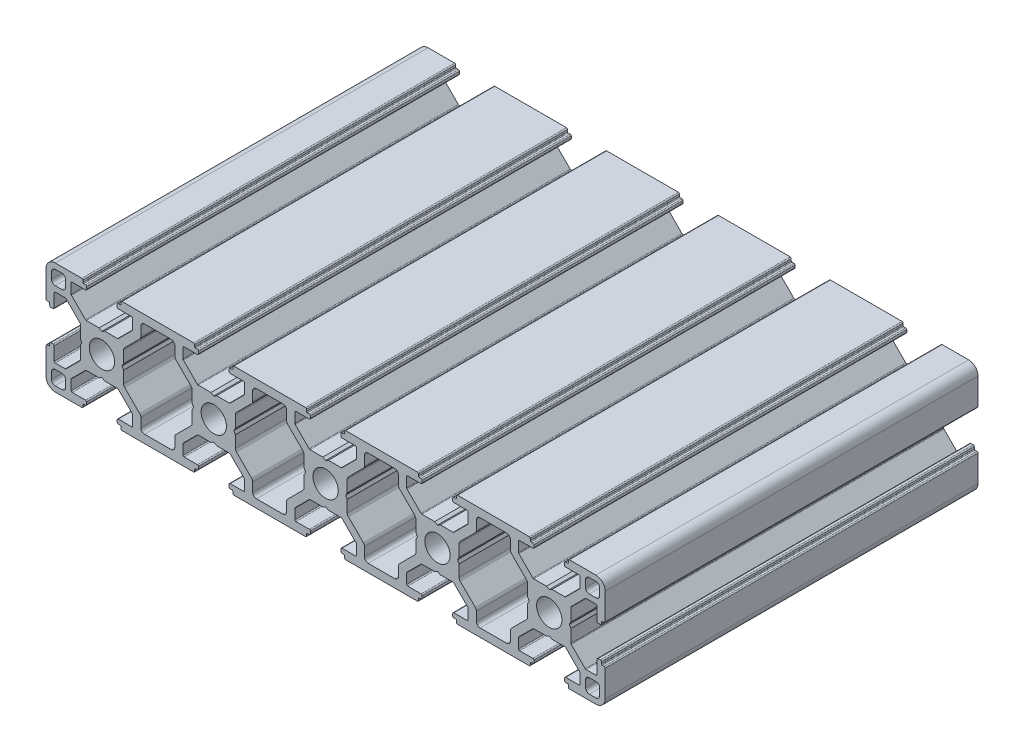
from build123d import *

# Parameters (mm, degrees)
SKETCH_1_R      = 3.400000029
EXTRUDE_1_DEPTH = 100


with BuildPart() as part:
    # 草图1 → 凸台-拉伸1 (new body)
    with BuildSketch(Plane.XY):
        with BuildLine():
            Line((25.811431149, -5.800000049), (29.249998985, -5.800000049))
            Line((29.249998985, -5.800000049), (29.999998991, -5.366987343))
            Line((29.999998991, -5.366987343), (30.749998997, -5.800000049))
            Line((30.749998997, -5.800000049), (34.188566832, -5.800000049))
            ThreePointArc((34.188566832, -5.800000049), (34.303402086, -5.82284871), (34.400745128, -5.887914284))
            Line((34.400745128, -5.887914284), (38.162177353, -9.650987533))
            ThreePointArc((38.162177353, -9.650987533), (38.227175437, -9.748298493), (38.24999906, -9.8630733))
            Line((38.24999906, -9.8630733), (38.24999906, -12.500000105))
            ThreePointArc((38.24999906, -12.500000105), (38.162131094, -12.712132141), (37.949999058, -12.800000108))
            Line((37.949999058, -12.800000108), (34.399999028, -12.800000108))
            ThreePointArc((34.399999028, -12.800000108), (34.187866992, -12.887868074), (34.099999025, -13.10000011))
            Line((34.099999025, -13.10000011), (34.099999025, -13.700000115))
            ThreePointArc((34.099999025, -13.700000115), (34.187866992, -13.912132151), (34.399999028, -14.000000118))
            Line((34.399999028, -14.000000118), (34.899999032, -14.000000118))
            ThreePointArc((34.899999032, -14.000000118), (35.04142039, -14.058578762), (35.099999034, -14.200000119))
            Line((35.099999034, -14.200000119), (35.099999034, -14.700000124))
            ThreePointArc((35.099999034, -14.700000124), (35.187867, -14.91213216), (35.399999036, -15.000000126))
            Line((35.399999036, -15.000000126), (54.599999198, -15.000000126))
            ThreePointArc((54.599999198, -15.000000126), (54.812131234, -14.91213216), (54.8999992, -14.700000124))
            Line((54.8999992, -14.700000124), (54.8999992, -14.200000119))
            ThreePointArc((54.8999992, -14.200000119), (54.958577845, -14.058578762), (55.099999202, -14.000000118))
            Line((55.099999202, -14.000000118), (55.599999206, -14.000000118))
            ThreePointArc((55.599999206, -14.000000118), (55.812131242, -13.912132151), (55.899999209, -13.700000115))
            Line((55.899999209, -13.700000115), (55.899999209, -13.10000011))
            ThreePointArc((55.899999209, -13.10000011), (55.812131242, -12.887868074), (55.599999206, -12.800000108))
            Line((55.599999206, -12.800000108), (52.049999176, -12.800000108))
            ThreePointArc((52.049999176, -12.800000108), (51.83786714, -12.712132141), (51.749999174, -12.500000105))
            Line((51.749999174, -12.500000105), (51.749999174, -9.8630733))
            ThreePointArc((51.749999174, -9.8630733), (51.772822797, -9.748298493), (51.837820881, -9.650987533))
            Line((51.837820881, -9.650987533), (55.599253107, -5.887914284))
            ThreePointArc((55.599253107, -5.887914284), (55.696596148, -5.82284871), (55.811431402, -5.800000049))
            Line((55.811431402, -5.800000049), (59.249999237, -5.800000049))
            Line((59.249999237, -5.800000049), (59.999999243, -5.366987343))
            Line((59.999999243, -5.366987343), (60.749999249, -5.800000049))
            Line((60.749999249, -5.800000049), (64.188567085, -5.800000049))
            ThreePointArc((64.188567085, -5.800000049), (64.303402338, -5.82284871), (64.40074538, -5.887914284))
            Line((64.40074538, -5.887914284), (68.162177605, -9.650987533))
            ThreePointArc((68.162177605, -9.650987533), (68.227175689, -9.748298493), (68.249999313, -9.8630733))
            Line((68.249999313, -9.8630733), (68.249999313, -12.500000105))
            ThreePointArc((68.249999313, -12.500000105), (68.162131346, -12.712132141), (67.94999931, -12.800000108))
            Line((67.94999931, -12.800000108), (64.39999928, -12.800000108))
            ThreePointArc((64.39999928, -12.800000108), (64.187867244, -12.887868074), (64.099999278, -13.10000011))
            Line((64.099999278, -13.10000011), (64.099999278, -13.700000115))
            ThreePointArc((64.099999278, -13.700000115), (64.187867244, -13.912132151), (64.39999928, -14.000000118))
            Line((64.39999928, -14.000000118), (64.899999284, -14.000000118))
            ThreePointArc((64.899999284, -14.000000118), (65.041420642, -14.058578762), (65.099999286, -14.200000119))
            Line((65.099999286, -14.200000119), (65.099999286, -14.700000124))
            ThreePointArc((65.099999286, -14.700000124), (65.187867252, -14.91213216), (65.399999289, -15.000000126))
            Line((65.399999289, -15.000000126), (84.59999945, -15.000000126))
            ThreePointArc((84.59999945, -15.000000126), (84.812131486, -14.91213216), (84.899999453, -14.700000124))
            Line((84.899999453, -14.700000124), (84.899999453, -14.200000119))
            ThreePointArc((84.899999453, -14.200000119), (84.958578097, -14.058578762), (85.099999454, -14.000000118))
            Line((85.099999454, -14.000000118), (85.599999458, -14.000000118))
            ThreePointArc((85.599999458, -14.000000118), (85.812131495, -13.912132151), (85.899999461, -13.700000115))
            Line((85.899999461, -13.700000115), (85.899999461, -13.10000011))
            ThreePointArc((85.899999461, -13.10000011), (85.812131495, -12.887868074), (85.599999458, -12.800000108))
            Line((85.599999458, -12.800000108), (82.049999429, -12.800000108))
            ThreePointArc((82.049999429, -12.800000108), (81.837867392, -12.712132141), (81.749999426, -12.500000105))
            Line((81.749999426, -12.500000105), (81.749999426, -9.8630733))
            ThreePointArc((81.749999426, -9.8630733), (81.772823049, -9.748298493), (81.837821134, -9.650987533))
            Line((81.837821134, -9.650987533), (85.599253359, -5.887914284))
            ThreePointArc((85.599253359, -5.887914284), (85.696596401, -5.82284871), (85.811431654, -5.800000049))
            Line((85.811431654, -5.800000049), (89.249999489, -5.800000049))
            Line((89.249999489, -5.800000049), (89.999999495, -5.366987343))
            Line((89.999999495, -5.366987343), (90.749999502, -5.800000049))
            Line((90.749999502, -5.800000049), (94.188567337, -5.800000049))
            ThreePointArc((94.188567337, -5.800000049), (94.30340259, -5.82284871), (94.400745632, -5.887914284))
            Line((94.400745632, -5.887914284), (98.162177857, -9.650987533))
            ThreePointArc((98.162177857, -9.650987533), (98.227175942, -9.748298493), (98.249999565, -9.8630733))
            Line((98.249999565, -9.8630733), (98.249999565, -12.500000105))
            ThreePointArc((98.249999565, -12.500000105), (98.162131598, -12.712132141), (97.949999562, -12.800000108))
            Line((97.949999562, -12.800000108), (94.399999532, -12.800000108))
            ThreePointArc((94.399999532, -12.800000108), (94.187867496, -12.887868074), (94.09999953, -13.10000011))
            Line((94.09999953, -13.10000011), (94.09999953, -13.700000115))
            ThreePointArc((94.09999953, -13.700000115), (94.187867496, -13.912132151), (94.399999532, -14.000000118))
            Line((94.399999532, -14.000000118), (94.899999537, -14.000000118))
            ThreePointArc((94.899999537, -14.000000118), (95.041420894, -14.058578762), (95.099999538, -14.200000119))
            Line((95.099999538, -14.200000119), (95.099999538, -14.700000124))
            ThreePointArc((95.099999538, -14.700000124), (95.187867505, -14.91213216), (95.399999541, -15.000000126))
            Line((95.399999541, -15.000000126), (114.599999703, -15.000000126))
            ThreePointArc((114.599999703, -15.000000126), (114.812131739, -14.91213216), (114.899999705, -14.700000124))
            Line((114.899999705, -14.700000124), (114.899999705, -14.200000119))
            ThreePointArc((114.899999705, -14.200000119), (114.958578349, -14.058578762), (115.099999707, -14.000000118))
            Line((115.099999707, -14.000000118), (115.599999711, -14.000000118))
            ThreePointArc((115.599999711, -14.000000118), (115.812131747, -13.912132151), (115.899999713, -13.700000115))
            Line((115.899999713, -13.700000115), (115.899999713, -13.10000011))
            ThreePointArc((115.899999713, -13.10000011), (115.812131747, -12.887868074), (115.599999711, -12.800000108))
            Line((115.599999711, -12.800000108), (112.049999681, -12.800000108))
            ThreePointArc((112.049999681, -12.800000108), (111.837867645, -12.712132141), (111.749999678, -12.500000105))
            Line((111.749999678, -12.500000105), (111.749999678, -9.8630733))
            ThreePointArc((111.749999678, -9.8630733), (111.772823301, -9.748298493), (111.837821386, -9.650987533))
            Line((111.837821386, -9.650987533), (115.599253611, -5.887914284))
            ThreePointArc((115.599253611, -5.887914284), (115.696596653, -5.82284871), (115.811431906, -5.800000049))
            Line((115.811431906, -5.800000049), (119.249999741, -5.800000049))
            Line((119.249999741, -5.800000049), (119.999999748, -5.366987343))
            Line((119.999999748, -5.366987343), (120.749999754, -5.800000049))
            Line((120.749999754, -5.800000049), (124.188567589, -5.800000049))
            ThreePointArc((124.188567589, -5.800000049), (124.303402843, -5.82284871), (124.400745884, -5.887914284))
            Line((124.400745884, -5.887914284), (128.16217811, -9.650987533))
            ThreePointArc((128.16217811, -9.650987533), (128.227176194, -9.748298493), (128.249999817, -9.8630733))
            Line((128.249999817, -9.8630733), (128.249999817, -12.500000105))
            ThreePointArc((128.249999817, -12.500000105), (128.162131851, -12.712132141), (127.949999815, -12.800000108))
            Line((127.949999815, -12.800000108), (124.399999785, -12.800000108))
            ThreePointArc((124.399999785, -12.800000108), (124.187867749, -12.887868074), (124.099999782, -13.10000011))
            Line((124.099999782, -13.10000011), (124.099999782, -13.700000115))
            ThreePointArc((124.099999782, -13.700000115), (124.187867749, -13.912132151), (124.399999785, -14.000000118))
            Line((124.399999785, -14.000000118), (124.899999789, -14.000000118))
            ThreePointArc((124.899999789, -14.000000118), (125.041421146, -14.058578762), (125.099999791, -14.200000119))
            Line((125.099999791, -14.200000119), (125.099999791, -14.700000124))
            ThreePointArc((125.099999791, -14.700000124), (125.187867757, -14.91213216), (125.399999793, -15.000000126))
            Line((125.399999793, -15.000000126), (132.499999853, -15.000000126))
            ThreePointArc((132.499999853, -15.000000126), (134.267766821, -14.267767073), (134.999999874, -12.500000105))
            Line((134.999999874, -12.500000105), (134.999999874, -5.400000045))
            ThreePointArc((134.999999874, -5.400000045), (134.912131907, -5.187868009), (134.699999871, -5.100000043))
            Line((134.699999871, -5.100000043), (134.199999867, -5.100000043))
            ThreePointArc((134.199999867, -5.100000043), (134.05857851, -5.041421399), (133.999999865, -4.900000041))
            Line((133.999999865, -4.900000041), (133.999999865, -4.400000037))
            ThreePointArc((133.999999865, -4.400000037), (133.912131899, -4.187868001), (133.699999863, -4.100000034))
            Line((133.699999863, -4.100000034), (133.099999858, -4.100000034))
            ThreePointArc((133.099999858, -4.100000034), (132.887867822, -4.187868001), (132.799999855, -4.400000037))
            Line((132.799999855, -4.400000037), (132.799999855, -7.950000067))
            ThreePointArc((132.799999855, -7.950000067), (132.712131889, -8.162132103), (132.499999853, -8.250000069))
            Line((132.499999853, -8.250000069), (129.855305017, -8.250000069))
            ThreePointArc((129.855305017, -8.250000069), (129.740469764, -8.227151408), (129.643126722, -8.162085834))
            Line((129.643126722, -8.162085834), (125.887821504, -4.405142266))
            ThreePointArc((125.887821504, -4.405142266), (125.82282342, -4.307831305), (125.799999796, -4.193056499))
            Line((125.799999796, -4.193056499), (125.799999796, -0.750000006))
            Line((125.799999796, -0.750000006), (125.366987091, 0))
            Line((125.366987091, 0), (125.799999796, 0.750000006))
            Line((125.799999796, 0.750000006), (125.799999796, 4.193056499))
            ThreePointArc((125.799999796, 4.193056499), (125.82282342, 4.307831305), (125.887821504, 4.405142266))
            Line((125.887821504, 4.405142266), (129.643126722, 8.162085834))
            ThreePointArc((129.643126722, 8.162085834), (129.740469764, 8.227151408), (129.855305017, 8.250000069))
            Line((129.855305017, 8.250000069), (132.499999853, 8.250000069))
            ThreePointArc((132.499999853, 8.250000069), (132.712131889, 8.162132103), (132.799999855, 7.950000067))
            Line((132.799999855, 7.950000067), (132.799999855, 4.400000037))
            ThreePointArc((132.799999855, 4.400000037), (132.887867822, 4.187868001), (133.099999858, 4.100000034))
            Line((133.099999858, 4.100000034), (133.699999863, 4.100000034))
            ThreePointArc((133.699999863, 4.100000034), (133.912131899, 4.187868001), (133.999999865, 4.400000037))
            Line((133.999999865, 4.400000037), (133.999999865, 4.900000041))
            ThreePointArc((133.999999865, 4.900000041), (134.05857851, 5.041421399), (134.199999867, 5.100000043))
            Line((134.199999867, 5.100000043), (134.699999871, 5.100000043))
            ThreePointArc((134.699999871, 5.100000043), (134.912131907, 5.187868009), (134.999999874, 5.400000045))
            Line((134.999999874, 5.400000045), (134.999999874, 12.500000105))
            ThreePointArc((134.999999874, 12.500000105), (134.267766821, 14.267767073), (132.499999853, 15.000000126))
            Line((132.499999853, 15.000000126), (125.399999793, 15.000000126))
            ThreePointArc((125.399999793, 15.000000126), (125.187867757, 14.91213216), (125.099999791, 14.700000124))
            Line((125.099999791, 14.700000124), (125.099999791, 14.200000119))
            ThreePointArc((125.099999791, 14.200000119), (125.041421146, 14.058578762), (124.899999789, 14.000000118))
            Line((124.899999789, 14.000000118), (124.399999785, 14.000000118))
            ThreePointArc((124.399999785, 14.000000118), (124.187867749, 13.912132151), (124.099999782, 13.700000115))
            Line((124.099999782, 13.700000115), (124.099999782, 13.10000011))
            ThreePointArc((124.099999782, 13.10000011), (124.187867749, 12.887868074), (124.399999785, 12.800000108))
            Line((124.399999785, 12.800000108), (127.949999815, 12.800000108))
            ThreePointArc((127.949999815, 12.800000108), (128.162131851, 12.712132141), (128.249999817, 12.500000105))
            Line((128.249999817, 12.500000105), (128.249999817, 9.8630733))
            ThreePointArc((128.249999817, 9.8630733), (128.227176194, 9.748298493), (128.16217811, 9.650987533))
            Line((128.16217811, 9.650987533), (124.400745884, 5.887914284))
            ThreePointArc((124.400745884, 5.887914284), (124.303402843, 5.82284871), (124.188567589, 5.800000049))
            Line((124.188567589, 5.800000049), (120.749999754, 5.800000049))
            Line((120.749999754, 5.800000049), (119.999999748, 5.366987343))
            Line((119.999999748, 5.366987343), (119.249999742, 5.800000049))
            Line((119.249999742, 5.800000049), (115.811431906, 5.800000049))
            ThreePointArc((115.811431906, 5.800000049), (115.696596653, 5.82284871), (115.599253611, 5.887914284))
            Line((115.599253611, 5.887914284), (111.837821386, 9.650987533))
            ThreePointArc((111.837821386, 9.650987533), (111.772823301, 9.748298493), (111.749999678, 9.8630733))
            Line((111.749999678, 9.8630733), (111.749999678, 12.500000105))
            ThreePointArc((111.749999678, 12.500000105), (111.837867645, 12.712132141), (112.049999681, 12.800000108))
            Line((112.049999681, 12.800000108), (115.599999711, 12.800000108))
            ThreePointArc((115.599999711, 12.800000108), (115.812131747, 12.887868074), (115.899999713, 13.10000011))
            Line((115.899999713, 13.10000011), (115.899999713, 13.700000115))
            ThreePointArc((115.899999713, 13.700000115), (115.812131747, 13.912132151), (115.599999711, 14.000000118))
            Line((115.599999711, 14.000000118), (115.099999707, 14.000000118))
            ThreePointArc((115.099999707, 14.000000118), (114.958578349, 14.058578762), (114.899999705, 14.200000119))
            Line((114.899999705, 14.200000119), (114.899999705, 14.700000124))
            ThreePointArc((114.899999705, 14.700000124), (114.812131738, 14.91213216), (114.599999702, 15.000000126))
            Line((114.599999702, 15.000000126), (95.399999541, 15.000000126))
            ThreePointArc((95.399999541, 15.000000126), (95.187867505, 14.91213216), (95.099999538, 14.700000124))
            Line((95.099999538, 14.700000124), (95.099999538, 14.200000119))
            ThreePointArc((95.099999538, 14.200000119), (95.041420894, 14.058578762), (94.899999537, 14.000000118))
            Line((94.899999537, 14.000000118), (94.399999532, 14.000000118))
            ThreePointArc((94.399999532, 14.000000118), (94.187867496, 13.912132151), (94.09999953, 13.700000115))
            Line((94.09999953, 13.700000115), (94.09999953, 13.10000011))
            ThreePointArc((94.09999953, 13.10000011), (94.187867496, 12.887868074), (94.399999532, 12.800000108))
            Line((94.399999532, 12.800000108), (97.949999562, 12.800000108))
            ThreePointArc((97.949999562, 12.800000108), (98.162131598, 12.712132141), (98.249999565, 12.500000105))
            Line((98.249999565, 12.500000105), (98.249999565, 9.8630733))
            ThreePointArc((98.249999565, 9.8630733), (98.227175942, 9.748298493), (98.162177857, 9.650987533))
            Line((98.162177857, 9.650987533), (94.400745632, 5.887914284))
            ThreePointArc((94.400745632, 5.887914284), (94.30340259, 5.82284871), (94.188567337, 5.800000049))
            Line((94.188567337, 5.800000049), (90.749999502, 5.800000049))
            Line((90.749999502, 5.800000049), (89.999999496, 5.366987343))
            Line((89.999999496, 5.366987343), (89.249999489, 5.800000049))
            Line((89.249999489, 5.800000049), (85.811431654, 5.800000049))
            ThreePointArc((85.811431654, 5.800000049), (85.696596401, 5.82284871), (85.599253359, 5.887914284))
            Line((85.599253359, 5.887914284), (81.837821134, 9.650987533))
            ThreePointArc((81.837821134, 9.650987533), (81.772823049, 9.748298493), (81.749999426, 9.8630733))
            Line((81.749999426, 9.8630733), (81.749999426, 12.500000105))
            ThreePointArc((81.749999426, 12.500000105), (81.837867392, 12.712132141), (82.049999429, 12.800000108))
            Line((82.049999429, 12.800000108), (85.599999458, 12.800000108))
            ThreePointArc((85.599999458, 12.800000108), (85.812131495, 12.887868074), (85.899999461, 13.10000011))
            Line((85.899999461, 13.10000011), (85.899999461, 13.700000115))
            ThreePointArc((85.899999461, 13.700000115), (85.812131495, 13.912132151), (85.599999458, 14.000000118))
            Line((85.599999458, 14.000000118), (85.099999454, 14.000000118))
            ThreePointArc((85.099999454, 14.000000118), (84.958578097, 14.058578762), (84.899999453, 14.200000119))
            Line((84.899999453, 14.200000119), (84.899999453, 14.700000124))
            ThreePointArc((84.899999453, 14.700000124), (84.812131486, 14.91213216), (84.59999945, 15.000000126))
            Line((84.59999945, 15.000000126), (65.399999289, 15.000000126))
            ThreePointArc((65.399999289, 15.000000126), (65.187867252, 14.91213216), (65.099999286, 14.700000124))
            Line((65.099999286, 14.700000124), (65.099999286, 14.200000119))
            ThreePointArc((65.099999286, 14.200000119), (65.041420642, 14.058578762), (64.899999284, 14.000000118))
            Line((64.899999284, 14.000000118), (64.39999928, 14.000000118))
            ThreePointArc((64.39999928, 14.000000118), (64.187867244, 13.912132151), (64.099999278, 13.700000115))
            Line((64.099999278, 13.700000115), (64.099999278, 13.10000011))
            ThreePointArc((64.099999278, 13.10000011), (64.187867244, 12.887868074), (64.39999928, 12.800000108))
            Line((64.39999928, 12.800000108), (67.94999931, 12.800000108))
            ThreePointArc((67.94999931, 12.800000108), (68.162131346, 12.712132141), (68.249999313, 12.500000105))
            Line((68.249999313, 12.500000105), (68.249999313, 9.8630733))
            ThreePointArc((68.249999313, 9.8630733), (68.227175689, 9.748298493), (68.162177605, 9.650987533))
            Line((68.162177605, 9.650987533), (64.40074538, 5.887914284))
            ThreePointArc((64.40074538, 5.887914284), (64.303402338, 5.82284871), (64.188567085, 5.800000049))
            Line((64.188567085, 5.800000049), (60.74999925, 5.800000049))
            Line((60.74999925, 5.800000049), (59.999999243, 5.366987343))
            Line((59.999999243, 5.366987343), (59.249999237, 5.800000049))
            Line((59.249999237, 5.800000049), (55.811431402, 5.800000049))
            ThreePointArc((55.811431402, 5.800000049), (55.696596148, 5.82284871), (55.599253107, 5.887914284))
            Line((55.599253107, 5.887914284), (51.837820881, 9.650987533))
            ThreePointArc((51.837820881, 9.650987533), (51.772822797, 9.748298493), (51.749999174, 9.8630733))
            Line((51.749999174, 9.8630733), (51.749999174, 12.500000105))
            ThreePointArc((51.749999174, 12.500000105), (51.83786714, 12.712132141), (52.049999176, 12.800000108))
            Line((52.049999176, 12.800000108), (55.599999206, 12.800000108))
            ThreePointArc((55.599999206, 12.800000108), (55.812131242, 12.887868074), (55.899999209, 13.10000011))
            Line((55.899999209, 13.10000011), (55.899999209, 13.700000115))
            ThreePointArc((55.899999209, 13.700000115), (55.812131242, 13.912132151), (55.599999206, 14.000000118))
            Line((55.599999206, 14.000000118), (55.099999202, 14.000000118))
            ThreePointArc((55.099999202, 14.000000118), (54.958577845, 14.058578762), (54.8999992, 14.200000119))
            Line((54.8999992, 14.200000119), (54.8999992, 14.700000124))
            ThreePointArc((54.8999992, 14.700000124), (54.812131234, 14.91213216), (54.599999198, 15.000000126))
            Line((54.599999198, 15.000000126), (35.399999036, 15.000000126))
            ThreePointArc((35.399999036, 15.000000126), (35.187867, 14.91213216), (35.099999034, 14.700000124))
            Line((35.099999034, 14.700000124), (35.099999034, 14.200000119))
            ThreePointArc((35.099999034, 14.200000119), (35.04142039, 14.058578762), (34.899999032, 14.000000118))
            Line((34.899999032, 14.000000118), (34.399999028, 14.000000118))
            ThreePointArc((34.399999028, 14.000000118), (34.187866992, 13.912132151), (34.099999025, 13.700000115))
            Line((34.099999025, 13.700000115), (34.099999025, 13.10000011))
            ThreePointArc((34.099999025, 13.10000011), (34.187866992, 12.887868074), (34.399999028, 12.800000108))
            Line((34.399999028, 12.800000108), (37.949999058, 12.800000108))
            ThreePointArc((37.949999058, 12.800000108), (38.162131094, 12.712132141), (38.24999906, 12.500000105))
            Line((38.24999906, 12.500000105), (38.24999906, 9.8630733))
            ThreePointArc((38.24999906, 9.8630733), (38.227175437, 9.748298493), (38.162177353, 9.650987533))
            Line((38.162177353, 9.650987533), (34.400745128, 5.887914284))
            ThreePointArc((34.400745128, 5.887914284), (34.303402086, 5.82284871), (34.188566832, 5.800000049))
            Line((34.188566832, 5.800000049), (30.749998997, 5.800000049))
            Line((30.749998997, 5.800000049), (29.999998991, 5.366987343))
            Line((29.999998991, 5.366987343), (29.249998985, 5.800000049))
            Line((29.249998985, 5.800000049), (25.811431149, 5.800000049))
            ThreePointArc((25.811431149, 5.800000049), (25.696595896, 5.82284871), (25.599252854, 5.887914284))
            Line((25.599252854, 5.887914284), (21.837820629, 9.650987533))
            ThreePointArc((21.837820629, 9.650987533), (21.772822545, 9.748298493), (21.749998922, 9.8630733))
            Line((21.749998922, 9.8630733), (21.749998922, 12.500000105))
            ThreePointArc((21.749998922, 12.500000105), (21.837866888, 12.712132141), (22.049998924, 12.800000108))
            Line((22.049998924, 12.800000108), (25.599998954, 12.800000108))
            ThreePointArc((25.599998954, 12.800000108), (25.81213099, 12.887868074), (25.899998956, 13.10000011))
            Line((25.899998956, 13.10000011), (25.899998956, 13.700000115))
            ThreePointArc((25.899998956, 13.700000115), (25.81213099, 13.912132151), (25.599998954, 14.000000118))
            Line((25.599998954, 14.000000118), (25.09999895, 14.000000118))
            ThreePointArc((25.09999895, 14.000000118), (24.958577592, 14.058578762), (24.899998948, 14.200000119))
            Line((24.899998948, 14.200000119), (24.899998948, 14.700000124))
            ThreePointArc((24.899998948, 14.700000124), (24.812130982, 14.91213216), (24.599998946, 15.000000126))
            Line((24.599998946, 15.000000126), (5.400000045, 15.000000126))
            ThreePointArc((5.400000045, 15.000000126), (5.187868009, 14.91213216), (5.100000043, 14.700000124))
            Line((5.100000043, 14.700000124), (5.100000043, 14.200000119))
            ThreePointArc((5.100000043, 14.200000119), (5.041421399, 14.058578762), (4.900000041, 14.000000118))
            Line((4.900000041, 14.000000118), (4.400000037, 14.000000118))
            ThreePointArc((4.400000037, 14.000000118), (4.187868001, 13.912132151), (4.100000034, 13.700000115))
            Line((4.100000034, 13.700000115), (4.100000034, 13.10000011))
            ThreePointArc((4.100000034, 13.10000011), (4.187868001, 12.887868074), (4.400000037, 12.800000108))
            Line((4.400000037, 12.800000108), (7.950000067, 12.800000108))
            ThreePointArc((7.950000067, 12.800000108), (8.162132103, 12.712132141), (8.250000069, 12.500000105))
            Line((8.250000069, 12.500000105), (8.250000069, 9.8630733))
            ThreePointArc((8.250000069, 9.8630733), (8.227176446, 9.748298493), (8.162178362, 9.650987533))
            Line((8.162178362, 9.650987533), (4.400746137, 5.887914284))
            ThreePointArc((4.400746137, 5.887914284), (4.303403095, 5.82284871), (4.188567842, 5.800000049))
            Line((4.188567842, 5.800000049), (0.750000006, 5.800000049))
            Line((0.750000006, 5.800000049), (0, 5.366987343))
            Line((0, 5.366987343), (-0.750000006, 5.800000049))
            Line((-0.750000006, 5.800000049), (-4.188567842, 5.800000049))
            ThreePointArc((-4.188567842, 5.800000049), (-4.303403095, 5.82284871), (-4.400746137, 5.887914284))
            Line((-4.400746137, 5.887914284), (-8.162178362, 9.650987533))
            ThreePointArc((-8.162178362, 9.650987533), (-8.227176446, 9.748298493), (-8.250000069, 9.8630733))
            Line((-8.250000069, 9.8630733), (-8.250000069, 12.500000105))
            ThreePointArc((-8.250000069, 12.500000105), (-8.162132103, 12.712132141), (-7.950000067, 12.800000108))
            Line((-7.950000067, 12.800000108), (-4.400000037, 12.800000108))
            ThreePointArc((-4.400000037, 12.800000108), (-4.187868001, 12.887868074), (-4.100000034, 13.10000011))
            Line((-4.100000034, 13.10000011), (-4.100000034, 13.700000115))
            ThreePointArc((-4.100000034, 13.700000115), (-4.187868001, 13.912132151), (-4.400000037, 14.000000118))
            Line((-4.400000037, 14.000000118), (-4.900000041, 14.000000118))
            ThreePointArc((-4.900000041, 14.000000118), (-5.041421399, 14.058578762), (-5.100000043, 14.200000119))
            Line((-5.100000043, 14.200000119), (-5.100000043, 14.700000124))
            ThreePointArc((-5.100000043, 14.700000124), (-5.187868009, 14.91213216), (-5.400000045, 15.000000126))
            Line((-5.400000045, 15.000000126), (-12.500000105, 15.000000126))
            ThreePointArc((-12.500000105, 15.000000126), (-14.267767073, 14.267767073), (-15.000000126, 12.500000105))
            Line((-15.000000126, 12.500000105), (-15.000000126, 5.400000045))
            ThreePointArc((-15.000000126, 5.400000045), (-14.91213216, 5.187868009), (-14.700000124, 5.100000043))
            Line((-14.700000124, 5.100000043), (-14.200000119, 5.100000043))
            ThreePointArc((-14.200000119, 5.100000043), (-14.058578762, 5.041421399), (-14.000000118, 4.900000041))
            Line((-14.000000118, 4.900000041), (-14.000000118, 4.400000037))
            ThreePointArc((-14.000000118, 4.400000037), (-13.912132151, 4.187868001), (-13.700000115, 4.100000034))
            Line((-13.700000115, 4.100000034), (-13.10000011, 4.100000034))
            ThreePointArc((-13.10000011, 4.100000034), (-12.887868074, 4.187868001), (-12.800000108, 4.400000037))
            Line((-12.800000108, 4.400000037), (-12.800000108, 7.950000067))
            ThreePointArc((-12.800000108, 7.950000067), (-12.712132141, 8.162132103), (-12.500000105, 8.250000069))
            Line((-12.500000105, 8.250000069), (-9.855305269, 8.250000069))
            ThreePointArc((-9.855305269, 8.250000069), (-9.740470016, 8.227151408), (-9.643126974, 8.162085834))
            Line((-9.643126974, 8.162085834), (-5.887821756, 4.405142266))
            ThreePointArc((-5.887821756, 4.405142266), (-5.822823672, 4.307831305), (-5.800000049, 4.193056499))
            Line((-5.800000049, 4.193056499), (-5.800000049, 0.750000006))
            Line((-5.800000049, 0.750000006), (-5.366987343, 0))
            Line((-5.366987343, 0), (-5.800000049, -0.750000006))
            Line((-5.800000049, -0.750000006), (-5.800000049, -4.193056499))
            ThreePointArc((-5.800000049, -4.193056499), (-5.822823672, -4.307831305), (-5.887821756, -4.405142266))
            Line((-5.887821756, -4.405142266), (-9.643126974, -8.162085834))
            ThreePointArc((-9.643126974, -8.162085834), (-9.740470016, -8.227151408), (-9.855305269, -8.250000069))
            Line((-9.855305269, -8.250000069), (-12.500000105, -8.250000069))
            ThreePointArc((-12.500000105, -8.250000069), (-12.712132141, -8.162132103), (-12.800000108, -7.950000067))
            Line((-12.800000108, -7.950000067), (-12.800000108, -4.400000037))
            ThreePointArc((-12.800000108, -4.400000037), (-12.887868074, -4.187868001), (-13.10000011, -4.100000034))
            Line((-13.10000011, -4.100000034), (-13.700000115, -4.100000034))
            ThreePointArc((-13.700000115, -4.100000034), (-13.912132151, -4.187868001), (-14.000000118, -4.400000037))
            Line((-14.000000118, -4.400000037), (-14.000000118, -4.900000041))
            ThreePointArc((-14.000000118, -4.900000041), (-14.058578762, -5.041421399), (-14.200000119, -5.100000043))
            Line((-14.200000119, -5.100000043), (-14.700000124, -5.100000043))
            ThreePointArc((-14.700000124, -5.100000043), (-14.91213216, -5.187868009), (-15.000000126, -5.400000045))
            Line((-15.000000126, -5.400000045), (-15.000000126, -12.500000105))
            ThreePointArc((-15.000000126, -12.500000105), (-14.267767073, -14.267767073), (-12.500000105, -15.000000126))
            Line((-12.500000105, -15.000000126), (-5.400000045, -15.000000126))
            ThreePointArc((-5.400000045, -15.000000126), (-5.187868009, -14.91213216), (-5.100000043, -14.700000124))
            Line((-5.100000043, -14.700000124), (-5.100000043, -14.200000119))
            ThreePointArc((-5.100000043, -14.200000119), (-5.041421399, -14.058578762), (-4.900000041, -14.000000118))
            Line((-4.900000041, -14.000000118), (-4.400000037, -14.000000118))
            ThreePointArc((-4.400000037, -14.000000118), (-4.187868001, -13.912132151), (-4.100000034, -13.700000115))
            Line((-4.100000034, -13.700000115), (-4.100000034, -13.10000011))
            ThreePointArc((-4.100000034, -13.10000011), (-4.187868001, -12.887868074), (-4.400000037, -12.800000108))
            Line((-4.400000037, -12.800000108), (-7.950000067, -12.800000108))
            ThreePointArc((-7.950000067, -12.800000108), (-8.162132103, -12.712132141), (-8.250000069, -12.500000105))
            Line((-8.250000069, -12.500000105), (-8.250000069, -9.8630733))
            ThreePointArc((-8.250000069, -9.8630733), (-8.227176446, -9.748298493), (-8.162178362, -9.650987533))
            Line((-8.162178362, -9.650987533), (-4.400746137, -5.887914284))
            ThreePointArc((-4.400746137, -5.887914284), (-4.303403095, -5.82284871), (-4.188567842, -5.800000049))
            Line((-4.188567842, -5.800000049), (-0.750000006, -5.800000049))
            Line((-0.750000006, -5.800000049), (0, -5.366987343))
            Line((0, -5.366987343), (0.750000006, -5.800000049))
            Line((0.750000006, -5.800000049), (4.188567842, -5.800000049))
            ThreePointArc((4.188567842, -5.800000049), (4.303403095, -5.82284871), (4.400746137, -5.887914284))
            Line((4.400746137, -5.887914284), (8.162178362, -9.650987533))
            ThreePointArc((8.162178362, -9.650987533), (8.227176446, -9.748298493), (8.250000069, -9.8630733))
            Line((8.250000069, -9.8630733), (8.250000069, -12.500000105))
            ThreePointArc((8.250000069, -12.500000105), (8.162132103, -12.712132141), (7.950000067, -12.800000108))
            Line((7.950000067, -12.800000108), (4.400000037, -12.800000108))
            ThreePointArc((4.400000037, -12.800000108), (4.187868001, -12.887868074), (4.100000034, -13.10000011))
            Line((4.100000034, -13.10000011), (4.100000034, -13.700000115))
            ThreePointArc((4.100000034, -13.700000115), (4.187868001, -13.912132151), (4.400000037, -14.000000118))
            Line((4.400000037, -14.000000118), (4.900000041, -14.000000118))
            ThreePointArc((4.900000041, -14.000000118), (5.041421399, -14.058578762), (5.100000043, -14.200000119))
            Line((5.100000043, -14.200000119), (5.100000043, -14.700000124))
            ThreePointArc((5.100000043, -14.700000124), (5.187868009, -14.91213216), (5.400000045, -15.000000126))
            Line((5.400000045, -15.000000126), (24.599998946, -15.000000126))
            ThreePointArc((24.599998946, -15.000000126), (24.812130982, -14.91213216), (24.899998948, -14.700000124))
            Line((24.899998948, -14.700000124), (24.899998948, -14.200000119))
            ThreePointArc((24.899998948, -14.200000119), (24.958577592, -14.058578762), (25.09999895, -14.000000118))
            Line((25.09999895, -14.000000118), (25.599998954, -14.000000118))
            ThreePointArc((25.599998954, -14.000000118), (25.81213099, -13.912132151), (25.899998956, -13.700000115))
            Line((25.899998956, -13.700000115), (25.899998956, -13.10000011))
            ThreePointArc((25.899998956, -13.10000011), (25.81213099, -12.887868074), (25.599998954, -12.800000108))
            Line((25.599998954, -12.800000108), (22.049998924, -12.800000108))
            ThreePointArc((22.049998924, -12.800000108), (21.837866888, -12.712132141), (21.749998922, -12.500000105))
            Line((21.749998922, -12.500000105), (21.749998922, -9.8630733))
            ThreePointArc((21.749998922, -9.8630733), (21.772822545, -9.748298493), (21.837820629, -9.650987533))
            Line((21.837820629, -9.650987533), (25.599252854, -5.887914284))
            ThreePointArc((25.599252854, -5.887914284), (25.696595896, -5.82284871), (25.811431149, -5.800000049))
        make_face()
        with Locations((119.999999748, 0)):
            Circle(SKETCH_1_R, mode=Mode.SUBTRACT)
        with Locations((89.999999495, 0)):
            Circle(SKETCH_1_R, mode=Mode.SUBTRACT)
        with Locations((29.999998991, 0)):
            Circle(SKETCH_1_R, mode=Mode.SUBTRACT)
        Circle(SKETCH_1_R, mode=Mode.SUBTRACT)
        with Locations((59.999999243, 0)):
            Circle(SKETCH_1_R, mode=Mode.SUBTRACT)
        with BuildLine():
            Line((133.524999861, 10.72500009), (133.524999861, 12.525000105))
            ThreePointArc((133.524999861, 12.525000105), (133.23210664, 13.232106892), (132.524999853, 13.525000114))
            Line((132.524999853, 13.525000114), (130.724999838, 13.525000114))
            ThreePointArc((130.724999838, 13.525000114), (130.017893051, 13.232106892), (129.72499983, 12.525000105))
            Line((129.72499983, 12.525000105), (129.72499983, 10.72500009))
            ThreePointArc((129.72499983, 10.72500009), (130.017893051, 10.017893303), (130.724999838, 9.725000082))
            Line((130.724999838, 9.725000082), (132.524999853, 9.725000082))
            ThreePointArc((132.524999853, 9.725000082), (133.23210664, 10.017893303), (133.524999861, 10.72500009))
        make_face(mode=Mode.SUBTRACT)
        with BuildLine():
            Line((65.799999292, 3.903196427), (65.799999292, 0.750000006))
            Line((65.799999292, 0.750000006), (65.366986586, 0))
            Line((65.366986586, 0), (65.799999292, -0.750000006))
            Line((65.799999292, -0.750000006), (65.799999292, -3.903196427))
            ThreePointArc((65.799999292, -3.903196427), (65.876078036, -4.285779115), (66.092738317, -4.610148984))
            Line((66.092738317, -4.610148984), (70.157260306, -8.676444227))
            ThreePointArc((70.157260306, -8.676444227), (70.373920587, -9.000814096), (70.449999331, -9.383396784))
            Line((70.449999331, -9.383396784), (70.449999331, -11.800000099))
            ThreePointArc((70.449999331, -11.800000099), (70.742892552, -12.507106886), (71.449999339, -12.800000108))
            Line((71.449999339, -12.800000108), (78.549999399, -12.800000108))
            ThreePointArc((78.549999399, -12.800000108), (79.257106186, -12.507106886), (79.549999408, -11.800000099))
            Line((79.549999408, -11.800000099), (79.549999408, -9.383396784))
            ThreePointArc((79.549999408, -9.383396784), (79.626078151, -9.000814096), (79.842738432, -8.676444227))
            Line((79.842738432, -8.676444227), (83.907260422, -4.610148984))
            ThreePointArc((83.907260422, -4.610148984), (84.123920703, -4.285779115), (84.199999447, -3.903196427))
            Line((84.199999447, -3.903196427), (84.199999447, -0.750000006))
            Line((84.199999447, -0.750000006), (84.633012152, 0))
            Line((84.633012152, 0), (84.199999447, 0.750000006))
            Line((84.199999447, 0.750000006), (84.199999447, 3.903196427))
            ThreePointArc((84.199999447, 3.903196427), (84.123920703, 4.285779115), (83.907260422, 4.610148984))
            Line((83.907260422, 4.610148984), (79.842738432, 8.676444227))
            ThreePointArc((79.842738432, 8.676444227), (79.626078151, 9.000814096), (79.549999408, 9.383396784))
            Line((79.549999408, 9.383396784), (79.549999408, 11.800000099))
            ThreePointArc((79.549999408, 11.800000099), (79.257106186, 12.507106886), (78.549999399, 12.800000108))
            Line((78.549999399, 12.800000108), (71.449999339, 12.800000108))
            ThreePointArc((71.449999339, 12.800000108), (70.742892552, 12.507106886), (70.449999331, 11.800000099))
            Line((70.449999331, 11.800000099), (70.449999331, 9.383396784))
            ThreePointArc((70.449999331, 9.383396784), (70.373920587, 9.000814096), (70.157260306, 8.676444227))
            Line((70.157260306, 8.676444227), (66.092738317, 4.610148984))
            ThreePointArc((66.092738317, 4.610148984), (65.876078036, 4.285779115), (65.799999292, 3.903196427))
        make_face(mode=Mode.SUBTRACT)
        with BuildLine():
            Line((-12.525000105, 9.725000082), (-10.72500009, 9.725000082))
            ThreePointArc((-10.72500009, 9.725000082), (-10.017893303, 10.017893303), (-9.725000082, 10.72500009))
            Line((-9.725000082, 10.72500009), (-9.725000082, 12.525000105))
            ThreePointArc((-9.725000082, 12.525000105), (-10.017893303, 13.232106892), (-10.72500009, 13.525000114))
            Line((-10.72500009, 13.525000114), (-12.525000105, 13.525000114))
            ThreePointArc((-12.525000105, 13.525000114), (-13.232106892, 13.232106892), (-13.525000114, 12.525000105))
            Line((-13.525000114, 12.525000105), (-13.525000114, 10.72500009))
            ThreePointArc((-13.525000114, 10.72500009), (-13.232106892, 10.017893303), (-12.525000105, 9.725000082))
        make_face(mode=Mode.SUBTRACT)
        with BuildLine():
            Line((-13.525000114, -10.72500009), (-13.525000114, -12.525000105))
            ThreePointArc((-13.525000114, -12.525000105), (-13.232106892, -13.232106892), (-12.525000105, -13.525000114))
            Line((-12.525000105, -13.525000114), (-10.72500009, -13.525000114))
            ThreePointArc((-10.72500009, -13.525000114), (-10.017893303, -13.232106892), (-9.725000082, -12.525000105))
            Line((-9.725000082, -12.525000105), (-9.725000082, -10.72500009))
            ThreePointArc((-9.725000082, -10.72500009), (-10.017893303, -10.017893303), (-10.72500009, -9.725000082))
            Line((-10.72500009, -9.725000082), (-12.525000105, -9.725000082))
            ThreePointArc((-12.525000105, -9.725000082), (-13.232106892, -10.017893303), (-13.525000114, -10.72500009))
        make_face(mode=Mode.SUBTRACT)
        with BuildLine():
            Line((5.799998787, 3.903196427), (5.799998787, 0.750000006))
            Line((5.799998787, 0.750000006), (5.366986082, 0))
            Line((5.366986082, 0), (5.799998787, -0.750000006))
            Line((5.799998787, -0.750000006), (5.799998787, -3.903196427))
            ThreePointArc((5.799998787, -3.903196427), (5.876077531, -4.285779115), (6.092737812, -4.610148984))
            Line((6.092737812, -4.610148984), (10.157259802, -8.676444227))
            ThreePointArc((10.157259802, -8.676444227), (10.373920083, -9.000814096), (10.449998827, -9.383396784))
            Line((10.449998827, -9.383396784), (10.449998827, -11.800000099))
            ThreePointArc((10.449998827, -11.800000099), (10.742892048, -12.507106886), (11.449998835, -12.800000108))
            Line((11.449998835, -12.800000108), (18.549998895, -12.800000108))
            ThreePointArc((18.549998895, -12.800000108), (19.257105682, -12.507106886), (19.549998903, -11.800000099))
            Line((19.549998903, -11.800000099), (19.549998903, -9.383396784))
            ThreePointArc((19.549998903, -9.383396784), (19.626077647, -9.000814096), (19.842737928, -8.676444227))
            Line((19.842737928, -8.676444227), (23.907259917, -4.610148984))
            ThreePointArc((23.907259917, -4.610148984), (24.123920198, -4.285779115), (24.199998942, -3.903196427))
            Line((24.199998942, -3.903196427), (24.199998942, -0.750000006))
            Line((24.199998942, -0.750000006), (24.633011648, 0))
            Line((24.633011648, 0), (24.199998942, 0.750000006))
            Line((24.199998942, 0.750000006), (24.199998942, 3.903196427))
            ThreePointArc((24.199998942, 3.903196427), (24.123920198, 4.285779115), (23.907259917, 4.610148984))
            Line((23.907259917, 4.610148984), (19.842737928, 8.676444227))
            ThreePointArc((19.842737928, 8.676444227), (19.626077647, 9.000814096), (19.549998903, 9.383396784))
            Line((19.549998903, 9.383396784), (19.549998903, 11.800000099))
            ThreePointArc((19.549998903, 11.800000099), (19.257105682, 12.507106886), (18.549998895, 12.800000108))
            Line((18.549998895, 12.800000108), (11.449998835, 12.800000108))
            ThreePointArc((11.449998835, 12.800000108), (10.742892048, 12.507106886), (10.449998827, 11.800000099))
            Line((10.449998827, 11.800000099), (10.449998827, 9.383396784))
            ThreePointArc((10.449998827, 9.383396784), (10.373920083, 9.000814096), (10.157259802, 8.676444227))
            Line((10.157259802, 8.676444227), (6.092737812, 4.610148984))
            ThreePointArc((6.092737812, 4.610148984), (5.876077531, 4.285779115), (5.799998787, 3.903196427))
        make_face(mode=Mode.SUBTRACT)
        with BuildLine():
            Line((35.79999904, 3.903196427), (35.79999904, 0.750000006))
            Line((35.79999904, 0.750000006), (35.366986334, 0))
            Line((35.366986334, 0), (35.79999904, -0.750000006))
            Line((35.79999904, -0.750000006), (35.79999904, -3.903196427))
            ThreePointArc((35.79999904, -3.903196427), (35.876077783, -4.285779115), (36.092738064, -4.610148984))
            Line((36.092738064, -4.610148984), (40.157260054, -8.676444227))
            ThreePointArc((40.157260054, -8.676444227), (40.373920335, -9.000814096), (40.449999079, -9.383396784))
            Line((40.449999079, -9.383396784), (40.449999079, -11.800000099))
            ThreePointArc((40.449999079, -11.800000099), (40.7428923, -12.507106886), (41.449999087, -12.800000108))
            Line((41.449999087, -12.800000108), (48.549999147, -12.800000108))
            ThreePointArc((48.549999147, -12.800000108), (49.257105934, -12.507106886), (49.549999155, -11.800000099))
            Line((49.549999155, -11.800000099), (49.549999155, -9.383396784))
            ThreePointArc((49.549999155, -9.383396784), (49.626077899, -9.000814096), (49.84273818, -8.676444227))
            Line((49.84273818, -8.676444227), (53.90726017, -4.610148984))
            ThreePointArc((53.90726017, -4.610148984), (54.123920451, -4.285779115), (54.199999194, -3.903196427))
            Line((54.199999194, -3.903196427), (54.199999194, -0.750000006))
            Line((54.199999194, -0.750000006), (54.6330119, 0))
            Line((54.6330119, 0), (54.199999194, 0.750000006))
            Line((54.199999194, 0.750000006), (54.199999194, 3.903196427))
            ThreePointArc((54.199999194, 3.903196427), (54.123920451, 4.285779115), (53.90726017, 4.610148984))
            Line((53.90726017, 4.610148984), (49.84273818, 8.676444227))
            ThreePointArc((49.84273818, 8.676444227), (49.626077899, 9.000814096), (49.549999155, 9.383396784))
            Line((49.549999155, 9.383396784), (49.549999155, 11.800000099))
            ThreePointArc((49.549999155, 11.800000099), (49.257105934, 12.507106886), (48.549999147, 12.800000108))
            Line((48.549999147, 12.800000108), (41.449999087, 12.800000108))
            ThreePointArc((41.449999087, 12.800000108), (40.7428923, 12.507106886), (40.449999079, 11.800000099))
            Line((40.449999079, 11.800000099), (40.449999079, 9.383396784))
            ThreePointArc((40.449999079, 9.383396784), (40.373920335, 9.000814096), (40.157260054, 8.676444227))
            Line((40.157260054, 8.676444227), (36.092738064, 4.610148984))
            ThreePointArc((36.092738064, 4.610148984), (35.876077783, 4.285779115), (35.79999904, 3.903196427))
        make_face(mode=Mode.SUBTRACT)
        with BuildLine():
            Line((114.199999699, 0.750000006), (114.199999699, 3.903196427))
            ThreePointArc((114.199999699, 3.903196427), (114.123920955, 4.285779115), (113.907260674, 4.610148984))
            Line((113.907260674, 4.610148984), (109.842738685, 8.676444227))
            ThreePointArc((109.842738685, 8.676444227), (109.626078404, 9.000814096), (109.54999966, 9.383396784))
            Line((109.54999966, 9.383396784), (109.54999966, 11.800000099))
            ThreePointArc((109.54999966, 11.800000099), (109.257106439, 12.507106886), (108.549999651, 12.800000108))
            Line((108.549999651, 12.800000108), (101.449999592, 12.800000108))
            ThreePointArc((101.449999592, 12.800000108), (100.742892805, 12.507106886), (100.449999583, 11.800000099))
            Line((100.449999583, 11.800000099), (100.449999583, 9.383396784))
            ThreePointArc((100.449999583, 9.383396784), (100.37392084, 9.000814096), (100.157260559, 8.676444227))
            Line((100.157260559, 8.676444227), (96.092738569, 4.610148984))
            ThreePointArc((96.092738569, 4.610148984), (95.876078288, 4.285779115), (95.799999544, 3.903196427))
            Line((95.799999544, 3.903196427), (95.799999544, 0.750000006))
            Line((95.799999544, 0.750000006), (95.366986839, 0))
            Line((95.366986839, 0), (95.799999544, -0.750000006))
            Line((95.799999544, -0.750000006), (95.799999544, -3.903196427))
            ThreePointArc((95.799999544, -3.903196427), (95.876078288, -4.285779115), (96.092738569, -4.610148984))
            Line((96.092738569, -4.610148984), (100.157260559, -8.676444227))
            ThreePointArc((100.157260559, -8.676444227), (100.37392084, -9.000814096), (100.449999583, -9.383396784))
            Line((100.449999583, -9.383396784), (100.449999583, -11.800000099))
            ThreePointArc((100.449999583, -11.800000099), (100.742892805, -12.507106886), (101.449999592, -12.800000108))
            Line((101.449999592, -12.800000108), (108.549999651, -12.800000108))
            ThreePointArc((108.549999651, -12.800000108), (109.257106439, -12.507106886), (109.54999966, -11.800000099))
            Line((109.54999966, -11.800000099), (109.54999966, -9.383396784))
            ThreePointArc((109.54999966, -9.383396784), (109.626078404, -9.000814096), (109.842738685, -8.676444227))
            Line((109.842738685, -8.676444227), (113.907260674, -4.610148984))
            ThreePointArc((113.907260674, -4.610148984), (114.123920955, -4.285779115), (114.199999699, -3.903196427))
            Line((114.199999699, -3.903196427), (114.199999699, -0.750000006))
            Line((114.199999699, -0.750000006), (114.633012404, 0))
            Line((114.633012404, 0), (114.199999699, 0.750000006))
        make_face(mode=Mode.SUBTRACT)
        with BuildLine():
            Line((132.524999853, -9.725000082), (130.724999838, -9.725000082))
            ThreePointArc((130.724999838, -9.725000082), (130.017893051, -10.017893303), (129.72499983, -10.72500009))
            Line((129.72499983, -10.72500009), (129.72499983, -12.525000105))
            ThreePointArc((129.72499983, -12.525000105), (130.017893051, -13.232106892), (130.724999838, -13.525000114))
            Line((130.724999838, -13.525000114), (132.524999853, -13.525000114))
            ThreePointArc((132.524999853, -13.525000114), (133.23210664, -13.232106892), (133.524999861, -12.525000105))
            Line((133.524999861, -12.525000105), (133.524999861, -10.72500009))
            ThreePointArc((133.524999861, -10.72500009), (133.23210664, -10.017893303), (132.524999853, -9.725000082))
        make_face(mode=Mode.SUBTRACT)
    extrude(amount=EXTRUDE_1_DEPTH)


solid = part.part
